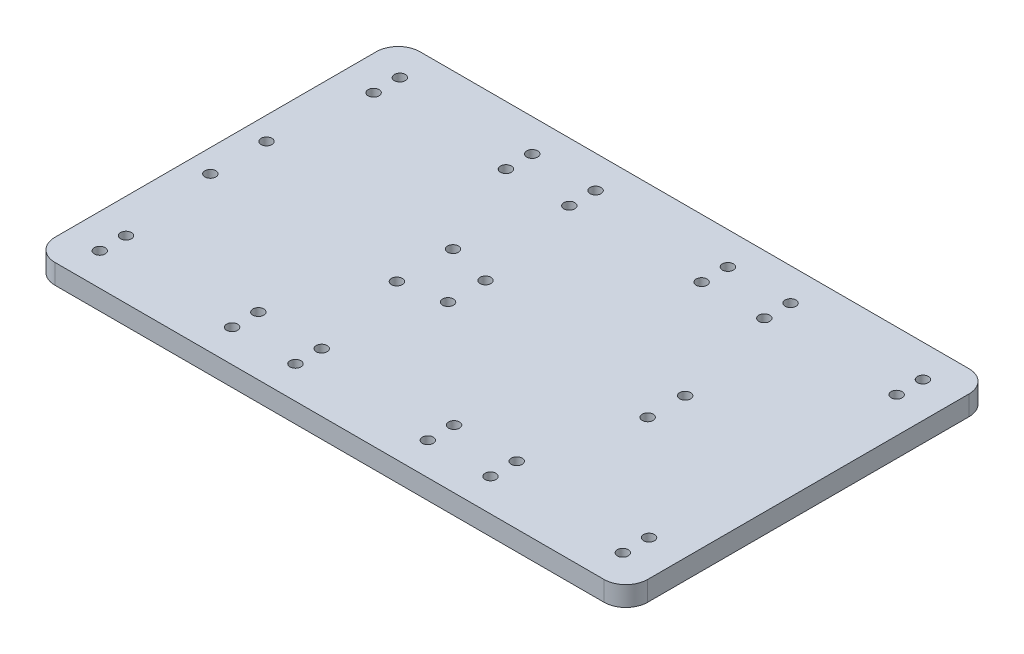
from build123d import *

# Parameters (mm, degrees)
SKETCH1_W           = 190
SKETCH1_H           = 117
BOSS_EXTRUDE1_DEPTH = 6.35
SS_HOLES_R          = 1.75
CUT_EXTRUDE1_DEPTH  = 224.224825008
FILLET1_R           = 7


with BuildPart() as part:
    # Sketch1 → Boss-Extrude1 (new body)
    with BuildSketch(Plane(origin=(0, 0, 0), x_dir=(1, 0, 0), z_dir=(0, 1, 0))):
        with Locations((95, 58.5)):
            Rectangle(SKETCH1_W, SKETCH1_H)
    extrude(amount=BOSS_EXTRUDE1_DEPTH)

    # SS Holes → Cut-Extrude1 (cut, through all)
    with BuildSketch(Plane.XZ):
        with Locations(Location((178.61822625, -98.18, 0), (0, 0, 270))):
            Circle(SS_HOLES_R)
        with Locations(Location((178.61822625, -106.6, 0), (0, 0, 270))):
            Circle(SS_HOLES_R)
        with Locations(Location((136.19822625, -98.18, 0), (0, 0, 270))):
            Circle(SS_HOLES_R)
        with Locations(Location((136.19822625, -106.6, 0), (0, 0, 270))):
            Circle(SS_HOLES_R)
        with Locations(Location((116.1046531, -106.6, 0), (0, 0, 270))):
            Circle(SS_HOLES_R)
        with Locations(Location((116.1046531, -98.18, 0), (0, 0, 270))):
            Circle(SS_HOLES_R)
        with Locations(Location((178.61822625, -18.82, 0), (0, 0, 270))):
            Circle(SS_HOLES_R)
        with Locations(Location((178.61822625, -10.4, 0), (0, 0, 270))):
            Circle(SS_HOLES_R)
        with Locations(Location((136.19822625, -18.82, 0), (0, 0, 270))):
            Circle(SS_HOLES_R)
        with Locations(Location((136.19822625, -10.4, 0), (0, 0, 270))):
            Circle(SS_HOLES_R)
        with Locations(Location((116.1046531, -18.82, 0), (0, 0, 270))):
            Circle(SS_HOLES_R)
        with Locations(Location((116.1046531, -10.4, 0), (0, 0, 270))):
            Circle(SS_HOLES_R)
        with Locations(Location((145, -52, 0), (0, 0, 270))):
            Circle(SS_HOLES_R)
        with Locations(Location((145, -64, 0), (0, 0, 270))):
            Circle(SS_HOLES_R)
        with Locations(Location((73.6846531, -10.4, 0), (0, 0, 270))):
            Circle(SS_HOLES_R)
        with Locations(Location((73.6846531, -18.82, 0), (0, 0, 270))):
            Circle(SS_HOLES_R)
        with Locations(Location((53.37164612, -18.82, 0), (0, 0, 270))):
            Circle(SS_HOLES_R)
        with Locations(Location((53.37164612, -10.4, 0), (0, 0, 270))):
            Circle(SS_HOLES_R)
        with Locations(Location((81, -52, 0), (0, 0, 270))):
            Circle(SS_HOLES_R)
        with Locations(Location((81, -64, 0), (0, 0, 270))):
            Circle(SS_HOLES_R)
        with Locations(Location((73.6846531, -98.18, 0), (0, 0, 270))):
            Circle(SS_HOLES_R)
        with Locations(Location((73.6846531, -106.6, 0), (0, 0, 270))):
            Circle(SS_HOLES_R)
        with Locations(Location((53.37164612, -106.6, 0), (0, 0, 270))):
            Circle(SS_HOLES_R)
        with Locations(Location((53.37164612, -98.18, 0), (0, 0, 270))):
            Circle(SS_HOLES_R)
        with Locations(Location((10.95164612, -106.6, 0), (0, 0, 270))):
            Circle(SS_HOLES_R)
        with Locations(Location((10.95164612, -98.18, 0), (0, 0, 270))):
            Circle(SS_HOLES_R)
        with Locations(Location((67.091245105, -67.5, 0), (0, 0, 270))):
            Circle(SS_HOLES_R)
        with Locations(Location((67.091245105, -49.5, 0), (0, 0, 270))):
            Circle(SS_HOLES_R)
        with Locations(Location((7.312777096, -49.5, 0), (0, 0, 270))):
            Circle(SS_HOLES_R)
        with Locations(Location((7.312777096, -67.5, 0), (0, 0, 270))):
            Circle(SS_HOLES_R)
        with Locations(Location((10.95164612, -18.82, 0), (0, 0, 270))):
            Circle(SS_HOLES_R)
        with Locations(Location((10.95164612, -10.4, 0), (0, 0, 270))):
            Circle(SS_HOLES_R)
    extrude(amount=-CUT_EXTRUDE1_DEPTH, mode=Mode.SUBTRACT)

    # Fillet1
    fillet1_edges = [part.edges().sort_by_distance(p)[0] for p in [
        (0, 3.175, -117),
        (190, 3.175, -117),
        (190, 3.175, 0),
        (0, 3.175, 0),
    ]]
    fillet(fillet1_edges, radius=FILLET1_R)


solid = part.part
